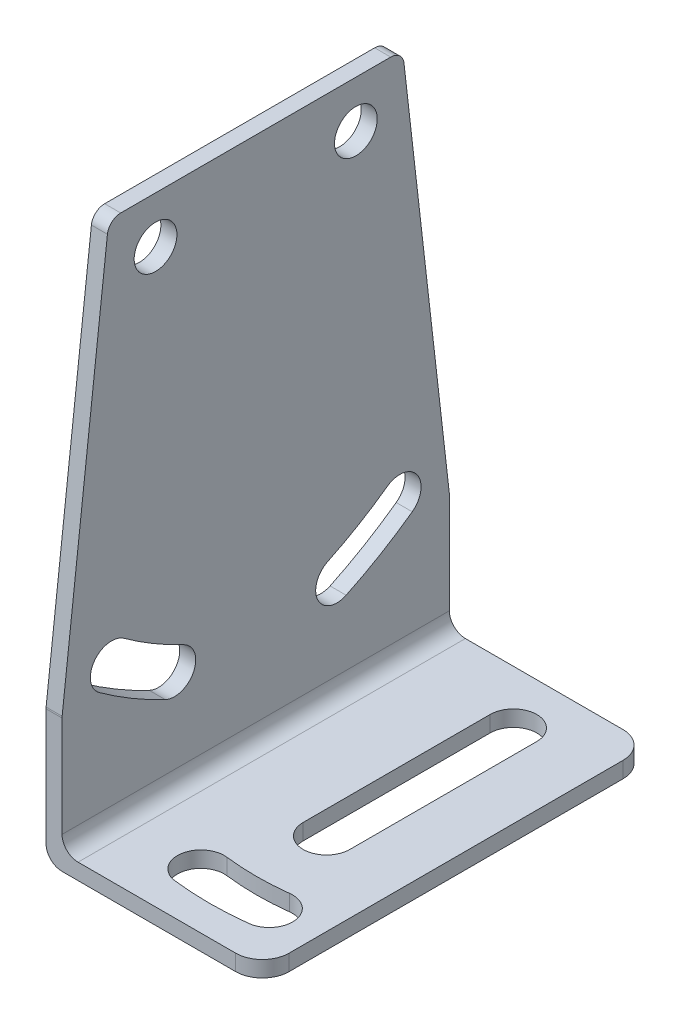
from build123d import *

# Parameters (mm, degrees)
SKETCH1_R           = 1.6
BOSS_EXTRUDE1_DEPTH = 1.2
SKETCH2_W           = 29
SKETCH2_H           = 1.2
BOSS_EXTRUDE2_DEPTH = 15
CUT_EXTRUDE1_DEPTH  = 45.913027063
FILLET1_R           = 1.2
FILLET2_R           = 1.2
FILLET3_R           = 2


with BuildPart() as part:
    # Sketch1 → Boss-Extrude1 (new body)
    with BuildSketch(Plane(origin=(0, 0, 0), x_dir=(0, 0, -1), z_dir=(1, 0, 0))):
        with BuildLine():
            Line((-7.5, 0), (7.5, 0))
            Line((7.5, 0), (10.108191381, 0))
            ThreePointArc((10.108191381, 0), (10.773771613, -0.253673694), (11.101671453, -0.88599409))
            Line((11.101671453, -0.88599409), (14.493480072, -30.44318348))
            ThreePointArc((14.493480072, -30.44318348), (14.498368687, -30.500093294), (14.5, -30.55718939))
            Line((14.5, -30.55718939), (14.5, -40.5))
            Line((14.5, -40.5), (-14.5, -40.5))
            Line((-14.5, -40.5), (-14.5, -30.556102861))
            ThreePointArc((-14.5, -30.556102861), (-14.498368572, -30.499004746), (-14.493479611, -30.442092935))
            Line((-14.493479611, -30.442092935), (-11.101674621, -0.885990074))
            ThreePointArc((-11.101674621, -0.885990074), (-10.773773734, -0.253672349), (-10.10819501, 0))
            Line((-10.10819501, 0), (-7.5, 0))
        make_face()
        with Locations((-7.5, -3.5)):
            Circle(SKETCH1_R, mode=Mode.SUBTRACT)
        with Locations(Location((7.5, -3.5, 0), (0, 0, 180))):
            Circle(SKETCH1_R, mode=Mode.SUBTRACT)
        with BuildLine():
            ThreePointArc((6.769643375, -33.224825582), (9.311234852, -31.868958813), (11.721023336, -30.290674494))
            ThreePointArc((11.721023336, -30.290674494), (12.081311767, -28.067489873), (9.858127146, -27.707201442))
            ThreePointArc((9.858127146, -27.707201442), (7.687475006, -29.128864072), (5.398099397, -30.350180849))
            ThreePointArc((5.398099397, -30.350180849), (4.64654902, -32.473275205), (6.769643375, -33.224825582))
        make_face(mode=Mode.SUBTRACT)
        with BuildLine():
            ThreePointArc((-6.769643375, -33.224825582), (-9.311234852, -31.868958813), (-11.721023336, -30.290674494))
            ThreePointArc((-11.721023336, -30.290674494), (-12.081311767, -28.067489873), (-9.858127146, -27.707201442))
            ThreePointArc((-9.858127146, -27.707201442), (-7.687475006, -29.128864072), (-5.398099397, -30.350180849))
            ThreePointArc((-5.398099397, -30.350180849), (-4.64654902, -32.473275205), (-6.769643375, -33.224825582))
        make_face(mode=Mode.SUBTRACT)
    extrude(amount=BOSS_EXTRUDE1_DEPTH)

    # Sketch2 → Boss-Extrude2 (add)
    with BuildSketch(Plane(origin=(1.2, 0, 0), x_dir=(0, 0, -1), z_dir=(1, 0, 0))):
        with Locations((0, -39.9)):
            Rectangle(SKETCH2_W, SKETCH2_H)
    extrude(amount=BOSS_EXTRUDE2_DEPTH)

    # Sketch3 → Cut-Extrude1 (cut, through all)
    with BuildSketch(Plane(origin=(0, -39.3, 0), x_dir=(1, 0, 0), z_dir=(0, 1, 0))):
        with BuildLine():
            Line((8.25, -3.5), (8.25, 10.5))
            ThreePointArc((8.25, 10.5), (10, 12.25), (11.75, 10.5))
            Line((11.75, 10.5), (11.75, -3.5))
            ThreePointArc((11.75, -3.5), (10, -5.25), (8.25, -3.5))
        make_face()
        with BuildLine():
            ThreePointArc((7.23117506, -12.08087557), (10, -12.24726258), (12.76882494, -12.08087557))
            ThreePointArc((12.76882494, -12.08087557), (14.296662597, -10.133900456), (12.349687483, -8.606062799))
            ThreePointArc((12.349687483, -8.606062799), (10, -8.74726258), (7.650312517, -8.606062799))
            ThreePointArc((7.650312517, -8.606062799), (5.703337403, -10.133900456), (7.23117506, -12.08087557))
        make_face()
    extrude(amount=-CUT_EXTRUDE1_DEPTH, mode=Mode.SUBTRACT)

    # Fillet1
    fillet1_edges = [part.edges().sort_by_distance(p)[0] for p in [
        (1.2, -39.3, 0),
    ]]
    fillet(fillet1_edges, radius=FILLET1_R)

    # Fillet2
    fillet2_edges = [part.edges().sort_by_distance(p)[0] for p in [
        (0, -40.5, 0),
    ]]
    fillet(fillet2_edges, radius=FILLET2_R)

    # Fillet3
    fillet3_edges = [part.edges().sort_by_distance(p)[0] for p in [
        (16.2, -39.9, 14.5),
        (16.2, -39.9, -14.5),
    ]]
    fillet(fillet3_edges, radius=FILLET3_R)


solid = part.part
